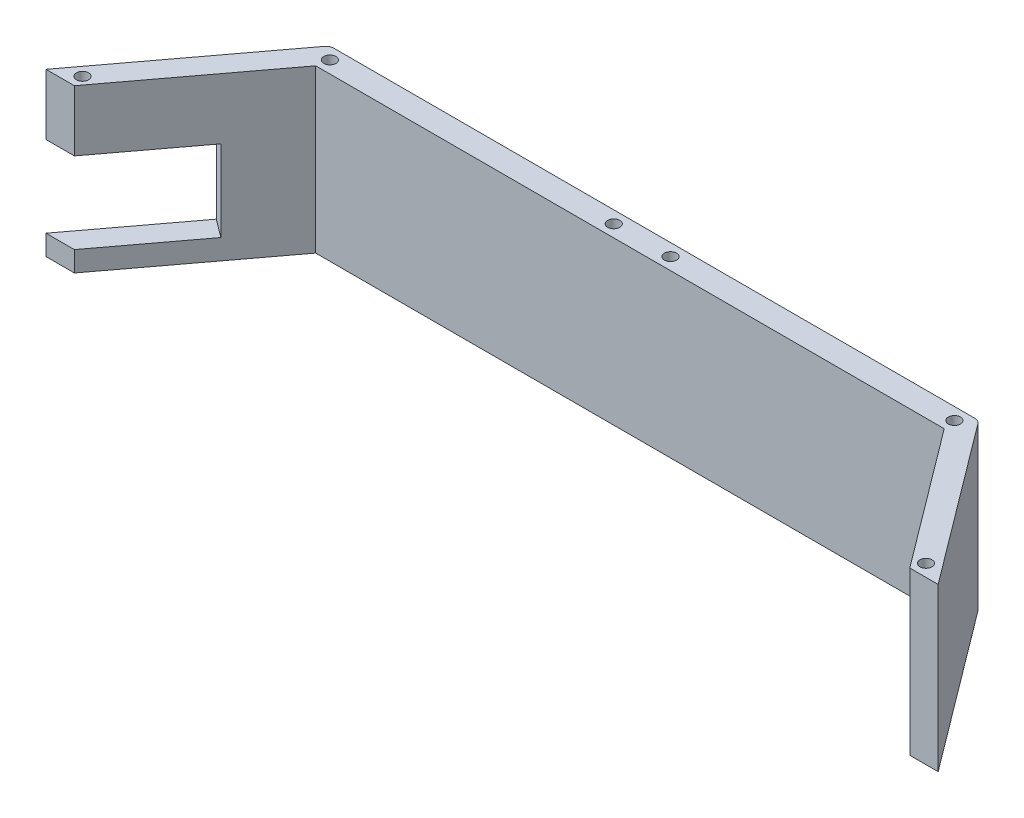
from build123d import *

# Parameters (mm, degrees)
BOSS_EXTRUDE1_DEPTH = 20
SKETCH2_R           = 1.5
CUT_EXTRUDE1_DEPTH  = 5
FILLET1_R           = 2
SKETCH3_W           = 30
SKETCH3_H           = 20
CUT_EXTRUDE2_DEPTH  = 10


with BuildPart() as part:
    # Sketch1 → Boss-Extrude1 (new, symmetric)
    with BuildSketch(Plane(origin=(0, 0, 0), x_dir=(1, 0, 0), z_dir=(0, 1, 0))):
        Polygon((-110, 0), (-80, 40), (80, 40), (110, 0), (103, 0), (77.5, 34), (-77.5, 34), (-103, 0), align=None)
    extrude(amount=BOSS_EXTRUDE1_DEPTH, both=True)

    # Sketch2 → Cut-Extrude1 (cut)
    with BuildSketch(Plane(origin=(0, 20, 0), x_dir=(1, 0, 0), z_dir=(0, 1, 0))):
        with Locations(Location((-104, 3, 0), (0, 0, 270))):
            Circle(SKETCH2_R)
        with Locations(Location((-77, 37, 0), (0, 0, 270))):
            Circle(SKETCH2_R)
        with Locations(Location((-7, 37, 0), (0, 0, 270))):
            Circle(SKETCH2_R)
        with Locations(Location((7, 37, 0), (0, 0, 90))):
            Circle(SKETCH2_R)
        with Locations(Location((77, 37, 0), (0, 0, 90))):
            Circle(SKETCH2_R)
        with Locations(Location((104, 3, 0), (0, 0, 90))):
            Circle(SKETCH2_R)
    extrude(amount=-CUT_EXTRUDE1_DEPTH, mode=Mode.SUBTRACT)

    # Fillet1
    fillet1_edges = [part.edges().sort_by_distance(p)[0] for p in [
        (-80, 0, -40),
        (80, 0, -40),
    ]]
    fillet(fillet1_edges, radius=FILLET1_R)

    # Sketch3 → Cut-Extrude2 (cut)
    with BuildSketch(Plane(origin=(-70.4, 0, -52.8), x_dir=(-0.5999999999999998, 0, 0.8000000000000003), z_dir=(-0.8000000000000004, 0, -0.5999999999999998))):
        with Locations((51, -5)):
            Rectangle(SKETCH3_W, SKETCH3_H)
    extrude(amount=-CUT_EXTRUDE2_DEPTH, mode=Mode.SUBTRACT)


solid = part.part
